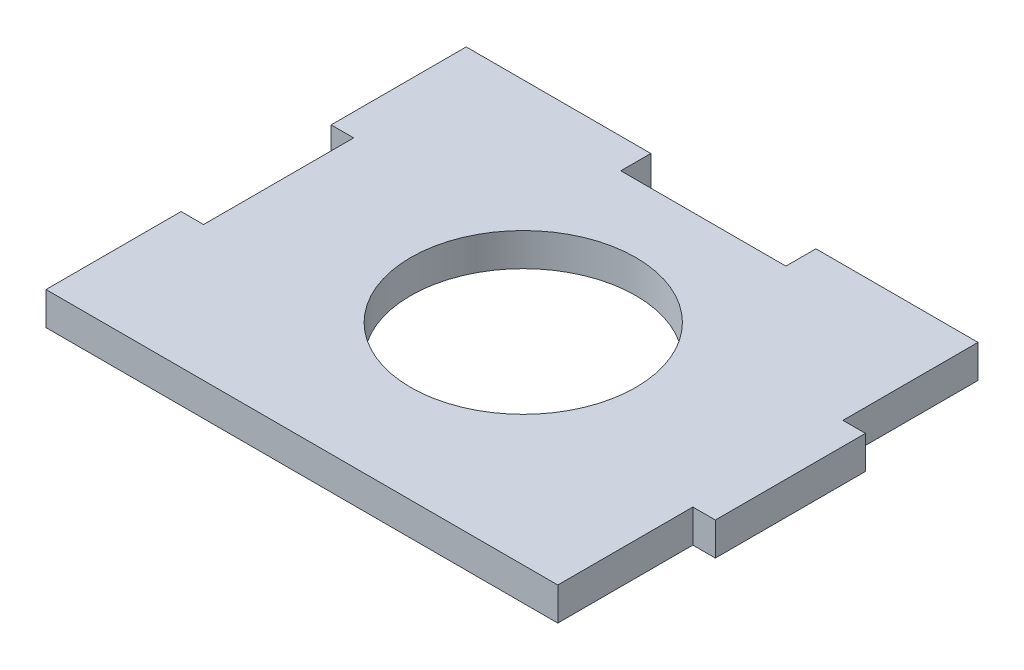
from build123d import *

# Parameters (mm, degrees)
SKETCH1_R           = 7.5
BOSS_EXTRUDE1_DEPTH = 2.2


with BuildPart() as part:
    # Sketch1 → Boss-Extrude1 (new body)
    with BuildSketch(Plane(origin=(0, 0, 0), x_dir=(1, 0, 0), z_dir=(0, 1, 0))):
        Polygon((-85.304574569, 129.705799117), (-74.504574569, 129.705799117), (-74.504574569, 120.705799117), (-73.004574569, 120.705799117), (-73.004574569, 110.705799117), (-74.504574569, 110.705799117), (-74.504574569, 101.705799117), (-108.604574569, 101.705799117), (-108.604574569, 110.705799117), (-107.104574569, 110.705799117), (-107.104574569, 120.705799117), (-108.604574569, 120.705799117), (-108.604574569, 129.705799117), (-96.304574569, 129.705799117), (-96.304574569, 127.705799117), (-85.304574569, 127.705799117), align=None)
        with Locations(Location((-90.804574569, 115.705799117, 0), (0, 0, 270))):
            Circle(SKETCH1_R, mode=Mode.SUBTRACT)
    extrude(amount=BOSS_EXTRUDE1_DEPTH)


solid = part.part
